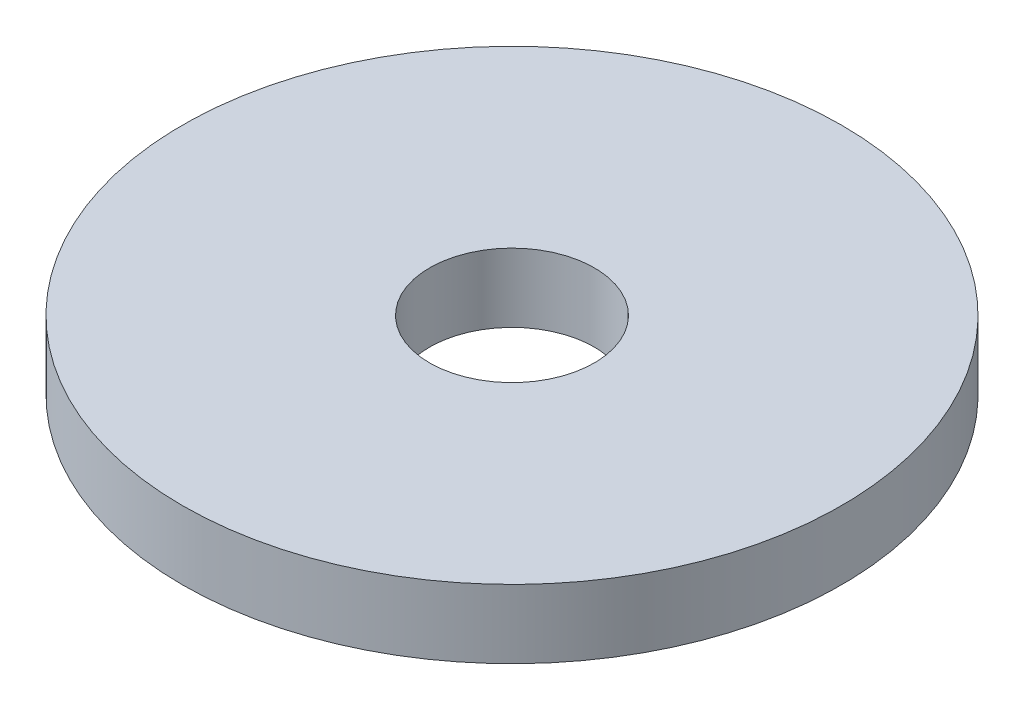
from build123d import *

# Parameters (mm, degrees)
SZKIC1_R                    = 12
DODANIE_WYCI_GNI_CIE1_DEPTH = 2.5
SZKIC2_R                    = 3
WYTNIJ_WYCI_GNI_CIE1_DEPTH  = 2.5


with BuildPart() as part:
    # Szkic1 → Dodanie-wyciągnięcie1 (new body)
    with BuildSketch(Plane(origin=(0, 0, 0), x_dir=(1, 0, 0), z_dir=(0, 1, 0))):
        with Locations(Location((0, 0, 0), (0, 0, 270))):
            Circle(SZKIC1_R)
    extrude(amount=DODANIE_WYCI_GNI_CIE1_DEPTH)

    # Szkic2 → Wytnij-wyciągnięcie1 (cut)
    with BuildSketch(Plane(origin=(0, 2.5, 0), x_dir=(1, 0, 0), z_dir=(0, 1, 0))):
        with Locations(Location((0, 0, 0), (0, 0, 270))):
            Circle(SZKIC2_R)
    extrude(amount=-WYTNIJ_WYCI_GNI_CIE1_DEPTH, mode=Mode.SUBTRACT)


solid = part.part
